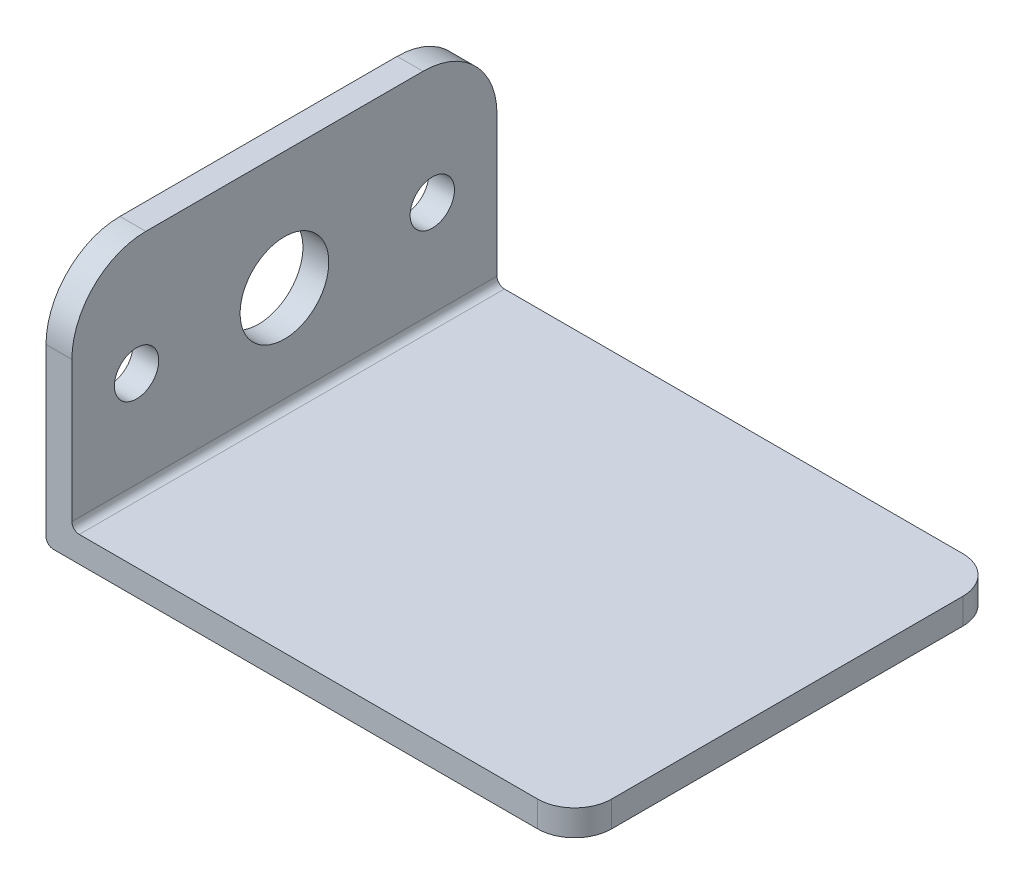
from build123d import *

# Parameters (mm, degrees)
SALIENTE_EXTRUIR1_DEPTH    = 28.75
REDONDEO1_R                = 5
REDONDEO2_R                = 10
REDONDEO3_R                = 1
CORTAR_EXTRUIR1_REACH      = 83.073
CROQUIS2_R                 = 3
CORTAR_EXTRUIR2_DEPTH      = 184.03816325
CORTAR_EXTRUIR2_DEPTH_BACK = 184.03816325
CROQUIS4_R                 = 5.999999992


with BuildPart() as part:
    # Croquis1 → Saliente-Extruir1 (new, symmetric)
    with BuildSketch(Plane.XY):
        Polygon((0, 33.5), (0, 0), (71.5, 0), (71.5, 3.5), (3.5, 3.5), (3.5, 33.5), align=None)
    extrude(amount=SALIENTE_EXTRUIR1_DEPTH, both=True)

    # Redondeo1
    redondeo1_edges = [part.edges().sort_by_distance(p)[0] for p in [
        (71.5, 1.75, -28.75),
        (71.5, 1.75, 28.75),
    ]]
    fillet(redondeo1_edges, radius=REDONDEO1_R)

    # Redondeo2
    redondeo2_edges = [part.edges().sort_by_distance(p)[0] for p in [
        (1.75, 33.5, 28.75),
        (1.75, 33.5, -28.75),
    ]]
    fillet(redondeo2_edges, radius=REDONDEO2_R)

    # Redondeo3
    redondeo3_edges = [part.edges().sort_by_distance(p)[0] for p in [
        (0, 0, 0),
        (3.5, 3.5, 0),
    ]]
    fillet(redondeo3_edges, radius=REDONDEO3_R)

    # Croquis2 → Cortar-Extruir1 (cut, up to next)
    with BuildSketch(Plane(origin=(3.5, 0, 0), x_dir=(0, 0, -1), z_dir=(1, 0, 0)), mode=Mode.PRIVATE) as cortar_extruir1_sk1:
        with Locations(Location((0, 17.5, 0), (0, 0, 90))):
            Circle(CROQUIS2_R)
    cortar_extruir1_tool1 = extrude(cortar_extruir1_sk1.sketch, amount=-CORTAR_EXTRUIR1_REACH, mode=Mode.PRIVATE) & part.part
    # Croquis2 → Cortar-Extruir1 (cut, up to next)
    with BuildSketch(Plane(origin=(3.5, 0, 0), x_dir=(0, 0, -1), z_dir=(1, 0, 0)), mode=Mode.PRIVATE) as cortar_extruir1_sk2:
        with Locations(Location((20, 17.5, 0), (0, 0, 90))):
            Circle(CROQUIS2_R)
    cortar_extruir1_tool2 = extrude(cortar_extruir1_sk2.sketch, amount=-CORTAR_EXTRUIR1_REACH, mode=Mode.PRIVATE) & part.part
    # Croquis2 → Cortar-Extruir1 (cut, up to next)
    with BuildSketch(Plane(origin=(3.5, 0, 0), x_dir=(0, 0, -1), z_dir=(1, 0, 0)), mode=Mode.PRIVATE) as cortar_extruir1_sk3:
        with Locations(Location((-20, 17.5, 0), (0, 0, 90))):
            Circle(CROQUIS2_R)
    cortar_extruir1_tool3 = extrude(cortar_extruir1_sk3.sketch, amount=-CORTAR_EXTRUIR1_REACH, mode=Mode.PRIVATE) & part.part
    add(cortar_extruir1_tool1.solids().sort_by_distance((3.5, 17.5, 0))[0], mode=Mode.SUBTRACT)
    add(cortar_extruir1_tool2.solids().sort_by_distance((3.5, 17.5, -20))[0], mode=Mode.SUBTRACT)
    add(cortar_extruir1_tool3.solids().sort_by_distance((3.5, 17.5, 20))[0], mode=Mode.SUBTRACT)

    # Croquis4 → Cortar-Extruir2 (cut, two sides: drawn at the far end of the back side and taken through both)
    with BuildSketch(Plane(origin=(-28.4, 19.037282969, -123.435876688), x_dir=(5.237222008265864e-15, 0.866025403784376, -0.5000000000001087), z_dir=(1, 0, 0)).offset(-CORTAR_EXTRUIR2_DEPTH_BACK)):
        with Locations(Location((-63.049264441, 106.129963469, 0), (0, 0, 120))):
            Circle(CROQUIS4_R)
    extrude(amount=CORTAR_EXTRUIR2_DEPTH + CORTAR_EXTRUIR2_DEPTH_BACK, mode=Mode.SUBTRACT)


solid = part.part
